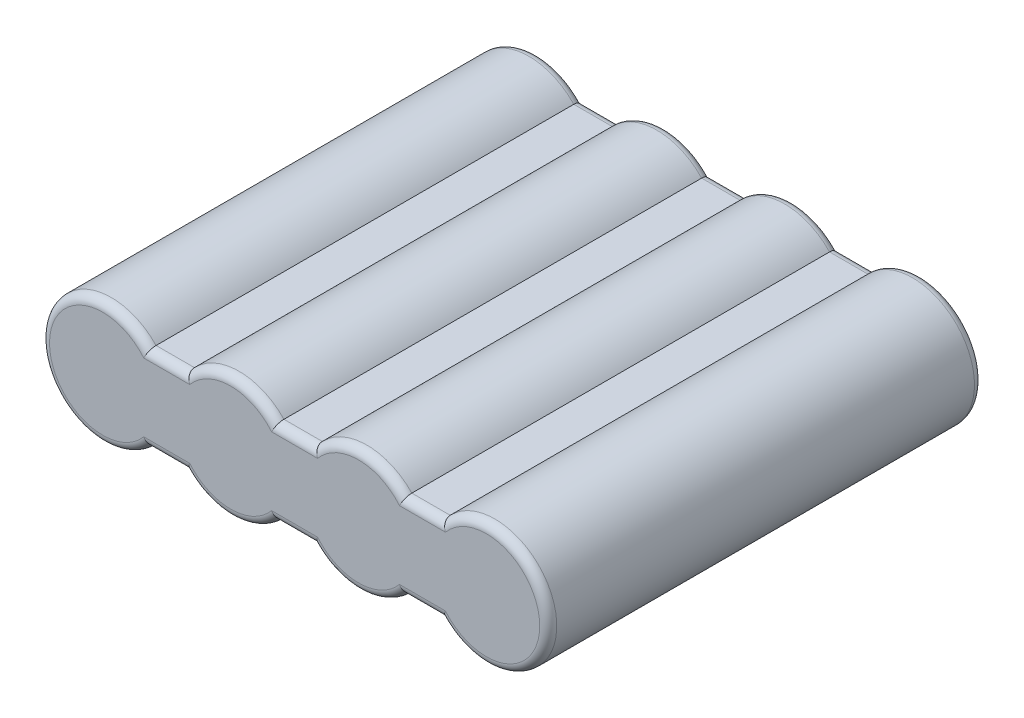
from build123d import *

# Parameters (mm, degrees)
BOSS_EXTRUDE1_DEPTH = 51
FILLET1_R           = 1


with BuildPart() as part:
    # Sketch1 → Boss-Extrude1 (new body)
    with BuildSketch(Plane.XY):
        with BuildLine():
            ThreePointArc((5.25, 5), (-7.25, 0), (5.25, -5))
            Line((5.25, -5), (9.75, -5))
            ThreePointArc((9.75, -5), (15, -7.25), (20.25, -5))
            Line((20.25, -5), (24.75, -5))
            ThreePointArc((24.75, -5), (30, -7.25), (35.25, -5))
            Line((35.25, -5), (39.75, -5))
            ThreePointArc((39.75, -5), (52.25, 0), (39.75, 5))
            Line((39.75, 5), (35.25, 5))
            ThreePointArc((35.25, 5), (30, 7.25), (24.75, 5))
            Line((24.75, 5), (20.25, 5))
            ThreePointArc((20.25, 5), (15, 7.25), (9.75, 5))
            Line((9.75, 5), (5.25, 5))
        make_face()
    extrude(amount=BOSS_EXTRUDE1_DEPTH)

    # Fillet1
    fillet1_edges = [part.edges().sort_by_distance(p)[0] for p in [
        (7.5, -5, 0),
        (15, -7.25, 0),
        (22.5, -5, 0),
        (30, -7.25, 0),
        (37.5, -5, 0),
        (52.25, 0, 0),
        (37.5, 5, 0),
        (30, 7.25, 0),
        (22.5, 5, 0),
        (15, 7.25, 0),
        (7.5, 5, 0),
        (-7.25, 0, 0),
        (7.5, 5, 51),
        (15, 7.25, 51),
        (22.5, 5, 51),
        (30, 7.25, 51),
        (37.5, 5, 51),
        (52.25, 0, 51),
        (37.5, -5, 51),
        (30, -7.25, 51),
        (22.5, -5, 51),
        (15, -7.25, 51),
        (7.5, -5, 51),
        (-7.25, 0, 51),
    ]]
    fillet(fillet1_edges, radius=FILLET1_R)


solid = part.part
